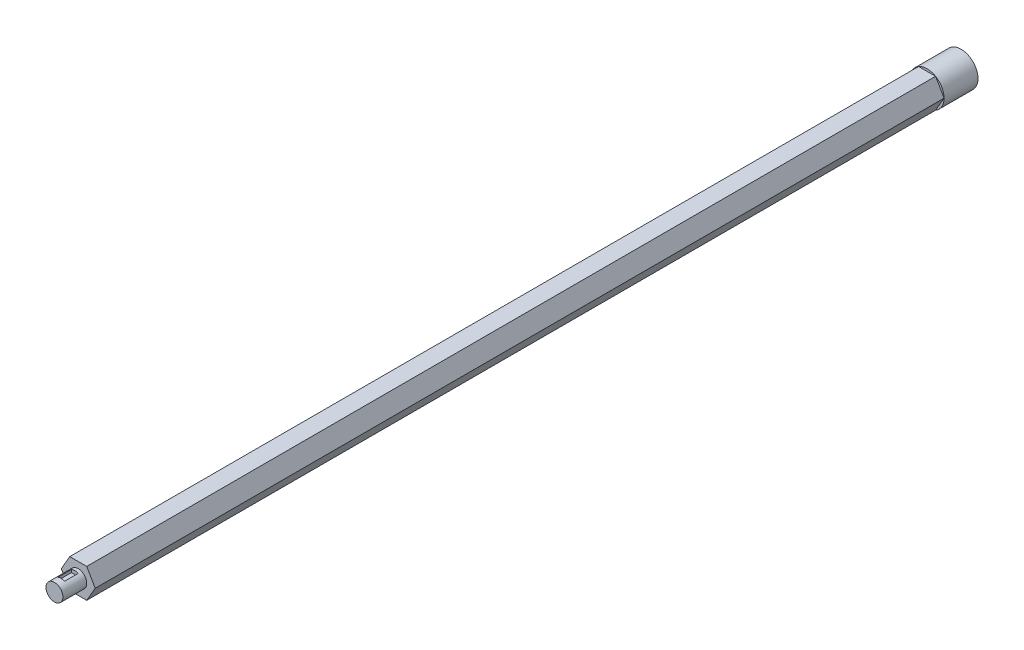
from build123d import *

# Parameters (mm, degrees)
EXTRUDE_1_DEPTH     = 250
SKETCH_2_R          = 2.5
EXTRUDE_2_DEPTH     = 10
SKETCH_3_R          = 5
EXTRUDE_3_DEPTH     = 10
SKETCH_4_W          = 2
SKETCH_4_H          = 1.835573614
CUT_EXTRUDE_1_DEPTH = 10
EXTRUDE_START       = -5
SKETCH_6_R          = 2.5
EXTRUDE_5_DEPTH     = 5
SKETCH_9_R          = 2.5
EXTRUDE_7_DEPTH     = 5
SKETCH_10_R         = 2.5
CUT_EXTRUDE_3_DEPTH = 3
CUT_EXTRUDE_START   = -3
SKETCH_11_R         = 2.5
CUT_EXTRUDE_4_DEPTH = 3
EXTRUDE_START_2     = -10
SKETCH_12_R         = 5
EXTRUDE_8_DEPTH     = 10
SKETCH_14_R         = 2.5
EXTRUDE_10_DEPTH    = 1


with BuildPart() as part:
    # 草图1 → 凸台-拉伸1 (new body)
    with BuildSketch(Plane.XY):
        Polygon((5, 0), (2.5, 4.330127019), (-2.5, 4.330127019), (-5, 0), (-2.5, -4.330127019), (2.5, -4.330127019), align=None)
    extrude(amount=EXTRUDE_1_DEPTH)

    # 草图2 → 凸台-拉伸2 (add)
    with BuildSketch(Plane.XY.offset(250)):
        Circle(SKETCH_2_R)
    extrude(amount=EXTRUDE_2_DEPTH)

    # 草图3 → 凸台-拉伸3 (add)
    with BuildSketch(Plane(origin=(0, 0, 0), x_dir=(-1, 0, 0), z_dir=(0, 0, -1))):
        Circle(SKETCH_3_R)
    extrude(amount=EXTRUDE_3_DEPTH)

    # 草图4 → 切除-拉伸1 (cut)
    with BuildSketch(Plane.XY.offset(260)):
        with Locations((0, 2.417786807)):
            Rectangle(SKETCH_4_W, SKETCH_4_H)
    extrude(amount=-CUT_EXTRUDE_1_DEPTH, mode=Mode.SUBTRACT)

    # 草图6 → 凸台-拉伸5 (add)
    with BuildSketch(Plane.XY.offset(260).offset(EXTRUDE_START)):
        with Locations(Location((0, 0, 0), (0, 0, 113.578178478))):
            Circle(SKETCH_6_R)
    extrude(amount=EXTRUDE_5_DEPTH)

    # 草图9 → 凸台-拉伸7 (add)
    with BuildSketch(Plane(origin=(0, 0, -10), x_dir=(-1, 0, 0), z_dir=(0, 0, -1))):
        with Locations(Location((0, 0, 0), (0, 0, 66.421821522))):
            Circle(SKETCH_9_R)
    extrude(amount=-EXTRUDE_7_DEPTH)

    # 草图10 → 切除-拉伸3 (cut)
    with BuildSketch(Plane(origin=(0, 0, -10), x_dir=(-1, 0, 0), z_dir=(0, 0, -1))):
        with Locations(Location((0, 0, 0), (0, 0, 66.421821522))):
            Circle(SKETCH_10_R)
    extrude(amount=-CUT_EXTRUDE_3_DEPTH, mode=Mode.SUBTRACT)

    # 草图11 → 切除-拉伸4 (cut)
    with BuildSketch(Plane.XY.offset(260).offset(CUT_EXTRUDE_START)):
        with Locations(Location((0, 0, 0), (0, 0, 113.578178478))):
            Circle(SKETCH_11_R)
    extrude(amount=CUT_EXTRUDE_4_DEPTH, mode=Mode.SUBTRACT)

    # 草图12 → 凸台-拉伸8 (add)
    with BuildSketch(Plane(origin=(0, 0, -10), x_dir=(-1, 0, 0), z_dir=(0, 0, -1)).offset(EXTRUDE_START_2)):
        Circle(SKETCH_12_R)
    extrude(amount=EXTRUDE_8_DEPTH)

    # 草图14 → 凸台-拉伸10 (add)
    with BuildSketch(Plane.XY.offset(250)):
        Circle(SKETCH_14_R)
    extrude(amount=EXTRUDE_10_DEPTH)


solid = part.part
